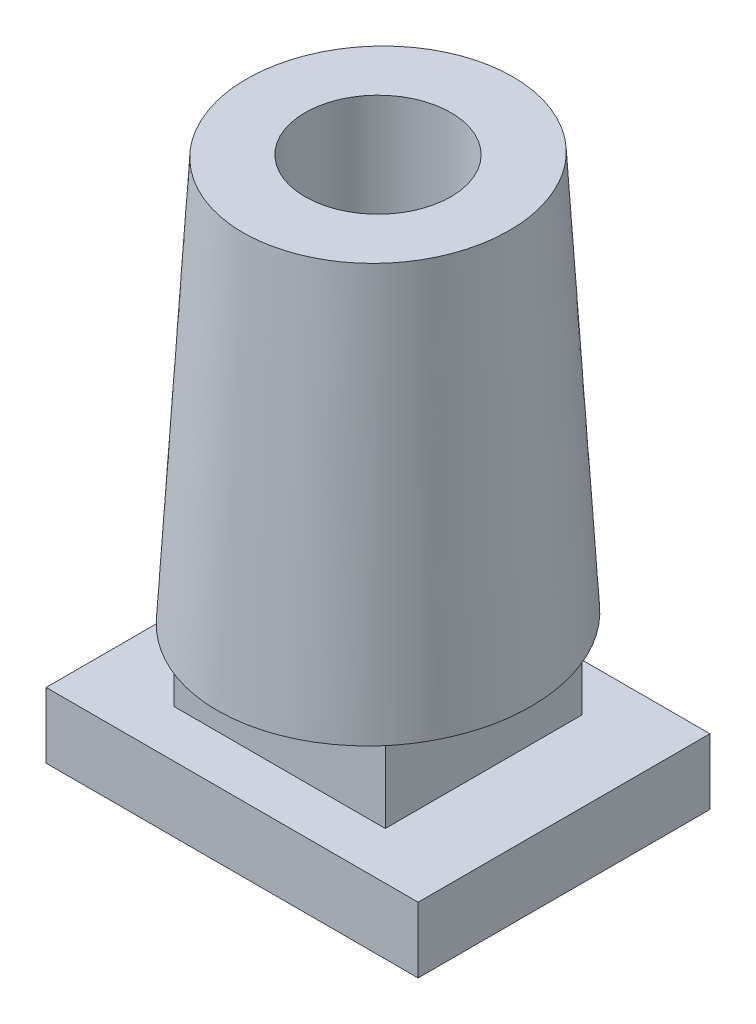
from build123d import *

# Parameters (mm, degrees)
SKETCH_4_W          = 10.2
SKETCH_4_H          = 8
EXTRUDE_1_DEPTH     = 1.8
SKETCH_5_W          = 5.8
SKETCH_5_H          = 5.4
EXTRUDE_2_DEPTH     = 2.2
SKETCH_7_RX         = 3.7
SKETCH_7_RY         = 3.6
SKETCH_6_RX         = 4.4
SKETCH_6_RY         = 4.2
SKETCH_8_R          = 2
CUT_EXTRUDE_1_DEPTH = 17.442931639


with BuildPart() as part:
    # 草图4 → 凸台-拉伸1 (new body)
    with BuildSketch(Plane(origin=(0, 0, 0), x_dir=(1, 0, 0), z_dir=(0, 1, 0))):
        Rectangle(SKETCH_4_W, SKETCH_4_H)
    extrude(amount=EXTRUDE_1_DEPTH)

    # 草图5 → 凸台-拉伸2 (add)
    with BuildSketch(Plane(origin=(0, 1.8, 0), x_dir=(1, 0, 0), z_dir=(0, 1, 0))):
        Rectangle(SKETCH_5_W, SKETCH_5_H)
    extrude(amount=EXTRUDE_2_DEPTH)

    # 草图7 → 放样1 section 0
    with BuildSketch(Plane(origin=(0, 15, 0), x_dir=(-1, 0, 0), z_dir=(0, -1, 0))):
        with Locations(Location((0, 0), (0, 0, -90))):
            Ellipse(SKETCH_7_RX, SKETCH_7_RY)
    # 草图6 → 放样1 section 1
    with BuildSketch(Plane(origin=(0, 4, 0), x_dir=(1, 0, 0), z_dir=(0, 1, 0))):
        with Locations(Location((0, 0), (0, 0, 90))):
            Ellipse(SKETCH_6_RX, SKETCH_6_RY)
    loft()

    # 草图8 → 切除-拉伸1 (cut, through all)
    with BuildSketch(Plane(origin=(0, 15, 0), x_dir=(1, 0, 0), z_dir=(0, 1, 0))):
        with Locations(Location((0, 0, 0), (0, 0, 270))):
            Circle(SKETCH_8_R)
    extrude(amount=-CUT_EXTRUDE_1_DEPTH, mode=Mode.SUBTRACT)


solid = part.part
